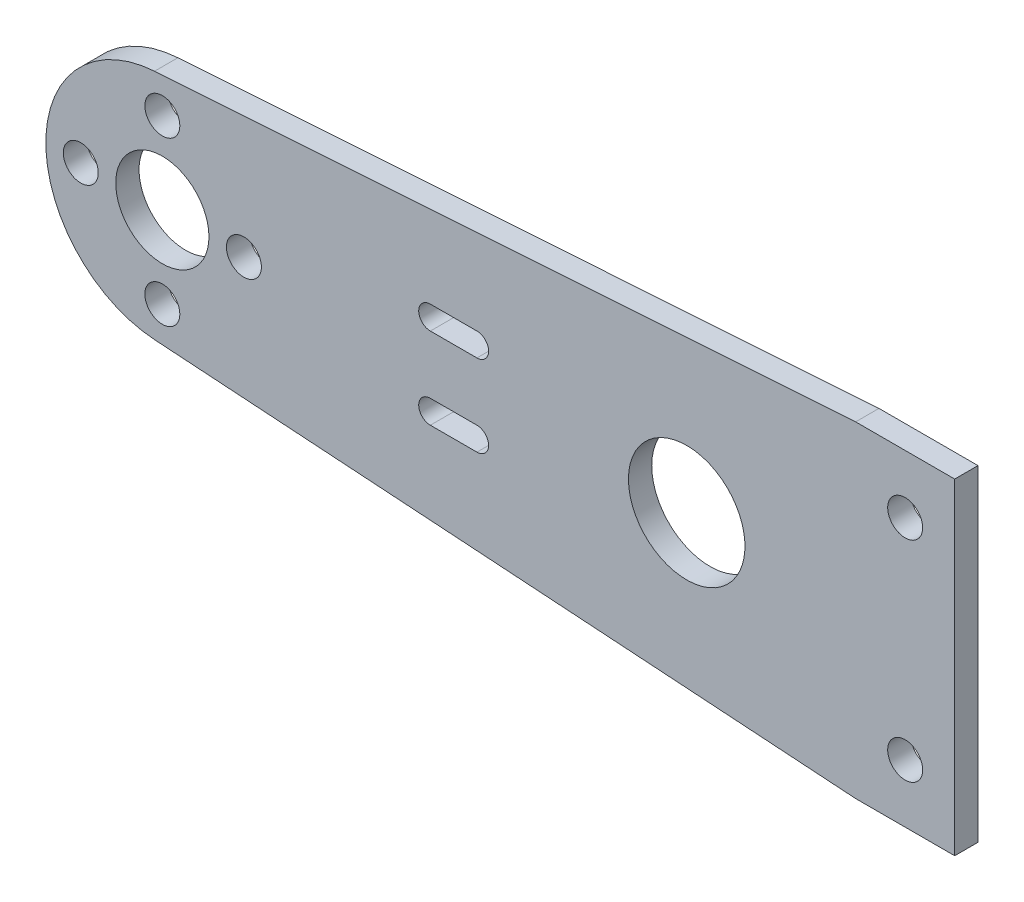
from build123d import *

# Parameters (mm, degrees)
SKETCH1_R          = 4
SKETCH1_R_2        = 1.5
EXTRUDE_1319_DEPTH = 2
SKETCH3_R          = 5
EXTRUDE3_DEPTH     = 70.455021417


with BuildPart() as part:
    # Sketch1 → Extrude 1319 (new body)
    with BuildSketch(Plane.XY):
        with BuildLine():
            Line((59.5, -14), (68, -14))
            Line((68, -14), (68, 14))
            Line((68, 14), (59.5, 14))
            Line((59.5, 14), (-0.667028635, 9.97772884))
            ThreePointArc((-0.667028635, 9.97772884), (-10, 0), (-0.667028635, -9.97772884))
            Line((-0.667028635, -9.97772884), (59.5, -14))
        make_face()
        Circle(SKETCH1_R, mode=Mode.SUBTRACT)
        with Locations((7, 0)):
            Circle(SKETCH1_R_2, mode=Mode.SUBTRACT)
        with Locations((0, -7)):
            Circle(SKETCH1_R_2, mode=Mode.SUBTRACT)
        with Locations((-7, 0)):
            Circle(SKETCH1_R_2, mode=Mode.SUBTRACT)
        with Locations((0, 7)):
            Circle(SKETCH1_R_2, mode=Mode.SUBTRACT)
        with Locations((63.75, -9)):
            Circle(SKETCH1_R_2, mode=Mode.SUBTRACT)
        with Locations((63.75, 9)):
            Circle(SKETCH1_R_2, mode=Mode.SUBTRACT)
    extrude(amount=EXTRUDE_1319_DEPTH)

    # Sketch3 → Extrude3 (cut, through all)
    with BuildSketch(Plane(origin=(0, 0, 0), x_dir=(-1, 0, 0), z_dir=(0, 0, -1))):
        with Locations((-45, 0)):
            Circle(SKETCH3_R)
        with BuildLine():
            Line((-27, -2.5), (-23, -2.5))
            ThreePointArc((-23, -2.5), (-22, -3.5), (-23, -4.5))
            Line((-23, -4.5), (-27, -4.5))
            ThreePointArc((-27, -4.5), (-28, -3.5), (-27, -2.5))
        make_face()
        with BuildLine():
            Line((-27, 2.5), (-23, 2.5))
            ThreePointArc((-23, 2.5), (-22, 3.5), (-23, 4.5))
            Line((-23, 4.5), (-27, 4.5))
            ThreePointArc((-27, 4.5), (-28, 3.5), (-27, 2.5))
        make_face()
    extrude(amount=-EXTRUDE3_DEPTH, mode=Mode.SUBTRACT)


solid = part.part
